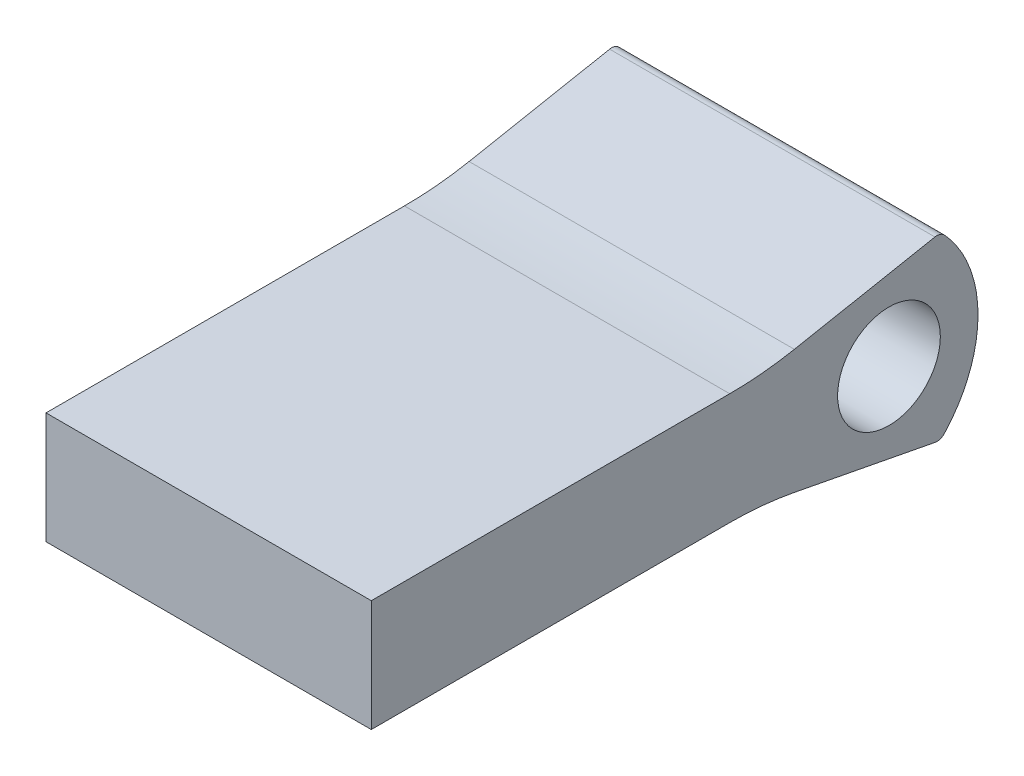
from build123d import *

# Parameters (mm, degrees)
SKETCH1_W                       = 9.5
SKETCH1_H                       = 3.26
BOSS_EXTRUDE1_DEPTH             = 11.42
BOSS_EXTRUDE3_REACH             = 14.475
BOSS_EXTRUDE3_DIRECTION_2_REACH = 14.475
FILLET1_R                       = 0.3
SKETCH4_R                       = 1.5
CUT_EXTRUDE1_DEPTH              = 16.081341077
FILLET2_R                       = 10


with BuildPart() as part:
    # Sketch1 → Boss-Extrude1 (new body)
    with BuildSketch(Plane.XY):
        Rectangle(SKETCH1_W, SKETCH1_H)
    extrude(amount=BOSS_EXTRUDE1_DEPTH)

    # Boss-Extrude3: up to this face of the body (flat: up to its plane)
    boss_extrude3_end = Plane(part.part.faces().sort_by_distance((-4.75, 0, 5.71))[0])
    # Sketch3 → Boss-Extrude3 (add, up to the picked face)
    with BuildSketch(Plane(origin=(0, 0, 0), x_dir=(0, 0, -1), z_dir=(1, 0, 0)), mode=Mode.PRIVATE) as boss_extrude3_sk1:
        with BuildLine():
            Line((0, -1.63), (5.2, -2.629157971))
            add(Edge.make_bspline(
                [(5.2, -2.629157971), (5.283052086, -2.547091023), (5.363844635, -2.459497383), (5.60978901, -2.164369944), (5.763042084, -1.936211317), (6.019426683, -1.436050674), (6.122353138, -1.164082205), (6.261824898, -0.594664263), (6.298216306, -0.297392436), (6.298215992, 0.297396341), (6.26182427, 0.594668129), (6.122351908, 1.164085924), (6.019425166, 1.436054284), (5.763040038, 1.936214656), (5.609786724, 2.164373121), (5.363842902, 2.459499262), (5.283051196, 2.547091902), (5.2, 2.629157971)],
                knots=[0.163498388, 0.163498388, 0.163498388, 0.163498388, 0.204239042, 0.204239042, 0.29258857, 0.29258857, 0.380938098, 0.380938098, 0.469287626, 0.469287626, 0.557637154, 0.557637154, 0.645986682, 0.645986682, 0.73433621, 0.73433621, 0.77507641, 0.77507641, 0.77507641, 0.77507641], degree=3))
            Line((5.2, 2.629157971), (0, 1.63))
            Line((0, 1.63), (0, -1.63))
        make_face()
    boss_extrude3_tool1 = split(extrude(boss_extrude3_sk1.sketch, amount=-BOSS_EXTRUDE3_REACH, mode=Mode.PRIVATE), bisect_by=boss_extrude3_end, keep=Keep.BOTH, mode=Mode.PRIVATE)
    add(boss_extrude3_tool1.solids().sort_by(Axis((0, 0, -3.236322), (-1, 0, 0)))[0])

    # Boss-Extrude3 direction 2: up to this face of the body (flat: up to its plane)
    boss_extrude3_direction_2_end = Plane(part.part.faces().sort_by_distance((4.75, 0, 5.71))[0])
    # Sketch3 → Boss-Extrude3 direction 2 (add, up to the picked face)
    with BuildSketch(Plane(origin=(0, 0, 0), x_dir=(0, 0, -1), z_dir=(1, 0, 0)), mode=Mode.PRIVATE) as boss_extrude3_direction_2_sk1:
        with BuildLine():
            Line((0, -1.63), (5.2, -2.629157971))
            add(Edge.make_bspline(
                [(5.2, -2.629157971), (5.283052086, -2.547091023), (5.363844635, -2.459497383), (5.60978901, -2.164369944), (5.763042084, -1.936211317), (6.019426683, -1.436050674), (6.122353138, -1.164082205), (6.261824898, -0.594664263), (6.298216306, -0.297392436), (6.298215992, 0.297396341), (6.26182427, 0.594668129), (6.122351908, 1.164085924), (6.019425166, 1.436054284), (5.763040038, 1.936214656), (5.609786724, 2.164373121), (5.363842902, 2.459499262), (5.283051196, 2.547091902), (5.2, 2.629157971)],
                knots=[0.163498388, 0.163498388, 0.163498388, 0.163498388, 0.204239042, 0.204239042, 0.29258857, 0.29258857, 0.380938098, 0.380938098, 0.469287626, 0.469287626, 0.557637154, 0.557637154, 0.645986682, 0.645986682, 0.73433621, 0.73433621, 0.77507641, 0.77507641, 0.77507641, 0.77507641], degree=3))
            Line((5.2, 2.629157971), (0, 1.63))
            Line((0, 1.63), (0, -1.63))
        make_face()
    boss_extrude3_direction_2_tool1 = split(extrude(boss_extrude3_direction_2_sk1.sketch, amount=BOSS_EXTRUDE3_DIRECTION_2_REACH, mode=Mode.PRIVATE), bisect_by=boss_extrude3_direction_2_end, keep=Keep.BOTH, mode=Mode.PRIVATE)
    add(boss_extrude3_direction_2_tool1.solids().sort_by(Axis((0, 0, -3.236322), (1, 0, 0)))[0])

    # Fillet1
    fillet1_edges = [part.edges().sort_by_distance(p)[0] for p in [
        (2.375, 2.629157971, -5.2),
        (2.375, -2.629157971, -5.2),
    ]]
    fillet(fillet1_edges, radius=FILLET1_R)

    # Sketch4 → Cut-Extrude1 (cut, through all)
    with BuildSketch(Plane(origin=(4.75, 0, 0), x_dir=(0, 0, -1), z_dir=(1, 0, 0))):
        with Locations((3.698216149, 0)):
            Circle(SKETCH4_R)
    extrude(amount=-CUT_EXTRUDE1_DEPTH, mode=Mode.SUBTRACT)

    # Fillet2
    fillet2_edges = [part.edges().sort_by_distance(p)[0] for p in [
        (0, 1.63, 0),
        (0, -1.63, 0),
    ]]
    fillet(fillet2_edges, radius=FILLET2_R)


solid = part.part
